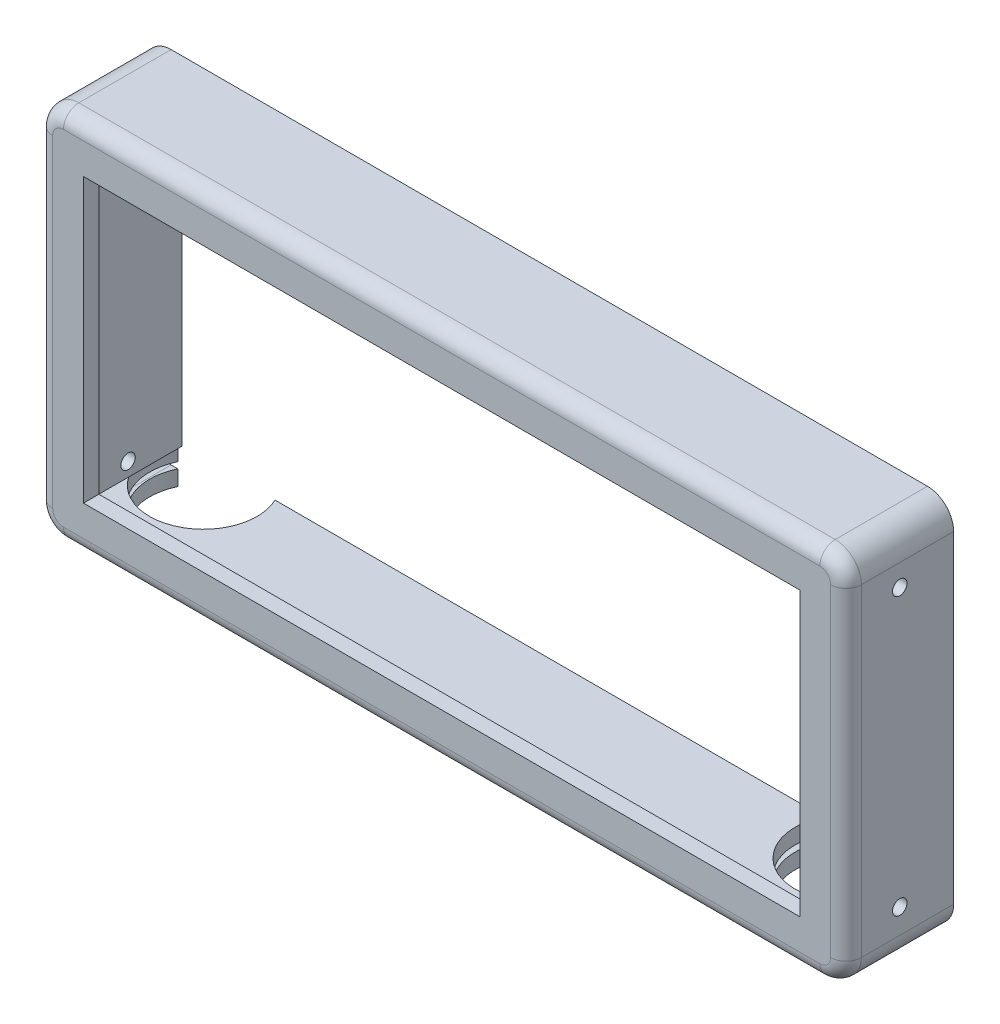
from build123d import *

# Parameters (mm, degrees)
SKETCH1_W             = 263
SKETCH1_H             = 122
SKETCH1_W_2           = 253
SKETCH1_H_2           = 112
BOSS_EXTRUDE1_DEPTH   = 30
SKETCH1_W_3           = 249
SKETCH1_H_3           = 108
SKETCH1_W_4           = 239
SKETCH1_H_4           = 98
BOSS_EXTRUDE1_2_DEPTH = 30
SKETCH2_W             = 263
SKETCH2_H             = 122
BOSS_EXTRUDE2_DEPTH   = 5
FILLET1_R             = 1.5
SKETCH3_R             = 17.5
CUT_EXTRUDE1_DEPTH    = 12
FILLET2_R             = 3.5
FILLET3_R             = 8.5
FILLET4_R             = 5
SKETCH4_R             = 2.35
CUT_EXTRUDE2_DEPTH    = 279
SKETCH5_W             = 233
SKETCH5_H             = 92
CUT_EXTRUDE3_DEPTH    = 10


with BuildPart() as part:
    # Sketch1 → Boss-Extrude1 (new body)
    with BuildSketch(Plane.XY):
        Rectangle(SKETCH1_W, SKETCH1_H)
        Rectangle(SKETCH1_W_2, SKETCH1_H_2, mode=Mode.SUBTRACT)
    extrude(amount=BOSS_EXTRUDE1_DEPTH)



with BuildPart() as body_2:
    # Sketch1 → Boss-Extrude1 2 (new body)
    with BuildSketch(Plane.XY):
        Rectangle(SKETCH1_W_3, SKETCH1_H_3)
        Rectangle(SKETCH1_W_4, SKETCH1_H_4, mode=Mode.SUBTRACT)
    extrude(amount=BOSS_EXTRUDE1_2_DEPTH)


with BuildPart() as part_1:
    add(part.part)

    add(body_2.part)  # Boss-Extrude2 merges body 2
    # Sketch2 → Boss-Extrude2 (add)
    with BuildSketch(Plane.XY.offset(30)):
        Rectangle(SKETCH2_W, SKETCH2_H)
    extrude(amount=BOSS_EXTRUDE2_DEPTH)

    # Fillet1
    fillet1_edges = [part_1.edges().sort_by_distance(p)[0] for p in [
        (-124.5, -54, 15),
        (124.5, -54, 15),
        (124.5, 54, 15),
        (-124.5, 54, 15),
    ]]
    fillet(fillet1_edges, radius=FILLET1_R)

    # Sketch3 → Cut-Extrude1 (cut)
    with BuildSketch(Plane(origin=(0, -61, 0), x_dir=(-1, 0, 0), z_dir=(0, -1, 0))):
        with Locations((105, -7.5)):
            Circle(SKETCH3_R)
        with Locations((-105, -7.5)):
            Circle(SKETCH3_R)
    extrude(amount=-CUT_EXTRUDE1_DEPTH, mode=Mode.SUBTRACT)

    # Fillet2
    fillet2_edges = [part_1.edges().sort_by_distance(p)[0] for p in [
        (126.5, 56, 15),
        (-126.5, 56, 15),
        (-126.5, -56, 15),
        (126.5, -56, 15),
    ]]
    fillet(fillet2_edges, radius=FILLET2_R)

    # Fillet3
    fillet3_edges = [part_1.edges().sort_by_distance(p)[0] for p in [
        (-131.5, -61, 17.5),
        (-131.5, 61, 17.5),
        (131.5, 61, 17.5),
        (131.5, -61, 17.5),
    ]]
    fillet(fillet3_edges, radius=FILLET3_R)

    # Fillet4
    fillet4_edges = [part_1.edges().sort_by_distance(p)[0] for p in [
        (0, -61, 35),
        (-131.5, 0, 35),
        (131.5, 0, 35),
        (0, 61, 35),
        (-129.01040764, 58.51040764, 35),
        (129.01040764, 58.51040764, 35),
        (129.01040764, -58.51040764, 35),
        (-129.01040764, -58.51040764, 35),
    ]]
    fillet(fillet4_edges, radius=FILLET4_R)

    # Sketch4 → Cut-Extrude2 (cut)
    with BuildSketch(Plane(origin=(131.5, 0, 0), x_dir=(0, 0, -1), z_dir=(1, 0, 0))):
        with Locations(Location((-17.5, -44.5, 0), (0, 0, 90))):
            Circle(SKETCH4_R)
        with Locations(Location((-17.5, 45.5, 0), (0, 0, 90))):
            Circle(SKETCH4_R)
    extrude(amount=-CUT_EXTRUDE2_DEPTH, mode=Mode.SUBTRACT)

    # Sketch5 → Cut-Extrude3 (cut)
    with BuildSketch(Plane.XY.offset(35)):
        Rectangle(SKETCH5_W, SKETCH5_H)
    extrude(amount=-CUT_EXTRUDE3_DEPTH, mode=Mode.SUBTRACT)


solid = part_1.part
